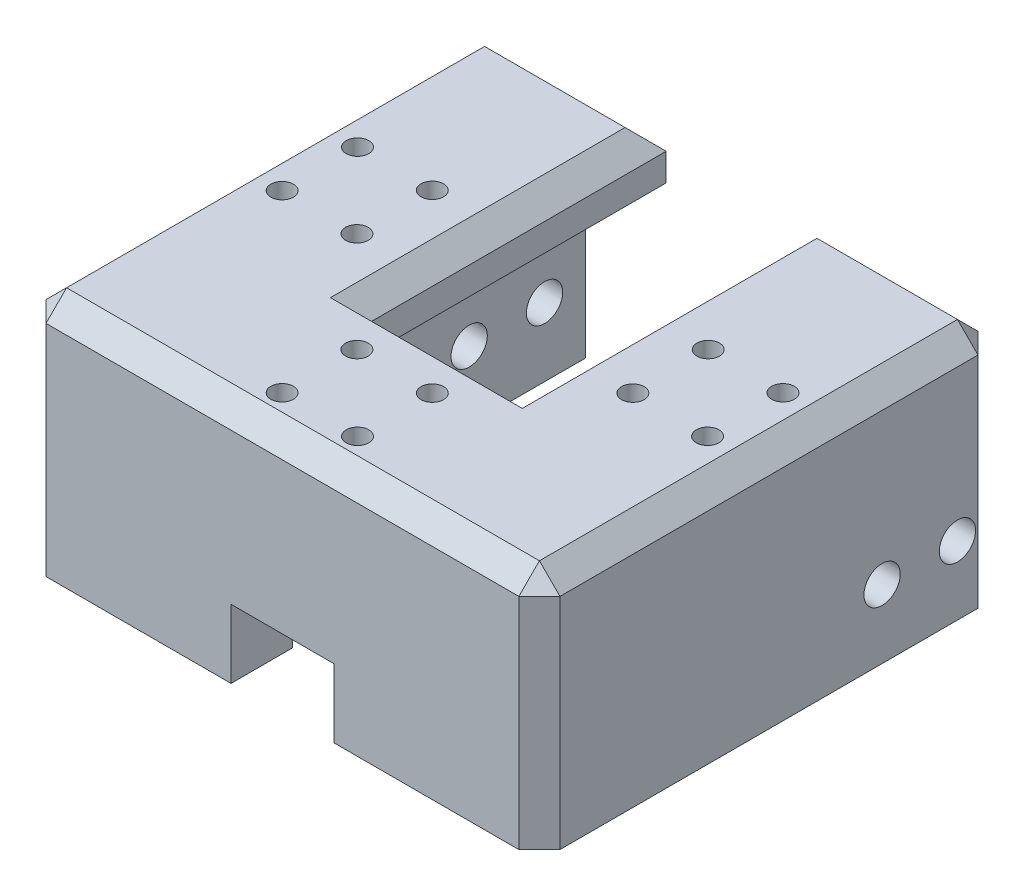
from build123d import *

# Parameters (mm, degrees)
SKETCH1_W                 = 75
SKETCH1_H                 = 35
BOSS_EXTRUDE1_DEPTH       = 67
SKETCH2_W                 = 45.5
SKETCH2_H                 = 28
CUT_EXTRUDE1_DEPTH        = 58
SKETCH4_W                 = 15
SKETCH4_H                 = 10
CUT_EXTRUDE2_DEPTH        = 72.249561402
SKETCH5_W                 = 22
SKETCH5_H                 = 7
CUT_EXTRUDE3_DEPTH        = 43
F_3_0MM_DOWEL_HOLE1_D     = 3.3
F_3_0MM_DOWEL_HOLE1_DEPTH = 10
F_3_0MM_DOWEL_HOLE1_TIP   = 0.991420021
SKETCH8_R                 = 2.65
CUT_EXTRUDE4_DEPTH        = 103.079625783
CHAMFER1_SIZE             = 3


with BuildPart() as part:
    # Sketch1 → Boss-Extrude1 (new body)
    with BuildSketch(Plane.XY):
        Rectangle(SKETCH1_W, SKETCH1_H)
    extrude(amount=-BOSS_EXTRUDE1_DEPTH)

    # Sketch2 → Cut-Extrude1 (cut)
    with BuildSketch(Plane(origin=(0, 0, -67), x_dir=(-1, 0, 0), z_dir=(0, 0, -1))):
        with Locations((0, -3.5)):
            Rectangle(SKETCH2_W, SKETCH2_H)
    extrude(amount=-CUT_EXTRUDE1_DEPTH, mode=Mode.SUBTRACT)

    # Sketch4 → Cut-Extrude2 (cut, through all)
    with BuildSketch(Plane(origin=(0, 0, -9), x_dir=(-1, 0, 0), z_dir=(0, 0, -1))):
        with Locations((0, -12.5)):
            Rectangle(SKETCH4_W, SKETCH4_H)
    extrude(amount=-CUT_EXTRUDE2_DEPTH, mode=Mode.SUBTRACT)

    # Sketch5 → Cut-Extrude3 (cut)
    with BuildSketch(Plane(origin=(0, 0, -67), x_dir=(-1, 0, 0), z_dir=(0, 0, -1))):
        with Locations((0, 14)):
            Rectangle(SKETCH5_W, SKETCH5_H)
    extrude(amount=-CUT_EXTRUDE3_DEPTH, mode=Mode.SUBTRACT)

    # Ø3.0mm Dowel Hole1
    with Locations(Plane(origin=(0, 17.5, 0), x_dir=(1, 0, 0), z_dir=(0, 1, 0))):
        with Locations((-31.04375, 31), (-31.04375, 42), (-20.13125, 42), (-20.13125, 31), (-5.5, 16.36875), (5.5, 16.36875), (-5.5, 5.45625), (5.5, 5.45625), (31.04375, 42), (20.13125, 42), (31.04375, 31), (20.13125, 31)):
            Hole(F_3_0MM_DOWEL_HOLE1_D / 2, depth=F_3_0MM_DOWEL_HOLE1_DEPTH)
            with Locations((0, 0, -(F_3_0MM_DOWEL_HOLE1_DEPTH + F_3_0MM_DOWEL_HOLE1_TIP / 2))):  # 118° drill point
                Cone(0, F_3_0MM_DOWEL_HOLE1_D / 2, F_3_0MM_DOWEL_HOLE1_TIP, mode=Mode.SUBTRACT)

    # Sketch8 → Cut-Extrude4 (cut, through all)
    with BuildSketch(Plane.ZY.offset(37.5)):
        with Locations((-61, -7.5)):
            Circle(SKETCH8_R)
        with Locations((-50, -7.5)):
            Circle(SKETCH8_R)
    extrude(amount=-CUT_EXTRUDE4_DEPTH, mode=Mode.SUBTRACT)

    # Chamfer1
    chamfer1_edges = [part.edges().sort_by_distance(p)[0] for p in [
        (37.5, 0, 0),
        (-37.5, 0, 0),
        (-37.5, 0, -67),
        (37.5, 0, -67),
        (0, 17.5, 0),
        (-37.5, 17.5, -33.5),
        (-24.25, 17.5, -67),
        (-11, 17.5, -45.5),
        (0, 17.5, -24),
        (11, 17.5, -45.5),
        (24.25, 17.5, -67),
        (37.5, 17.5, -33.5),
    ]]
    chamfer(chamfer1_edges, length=CHAMFER1_SIZE)


solid = part.part
